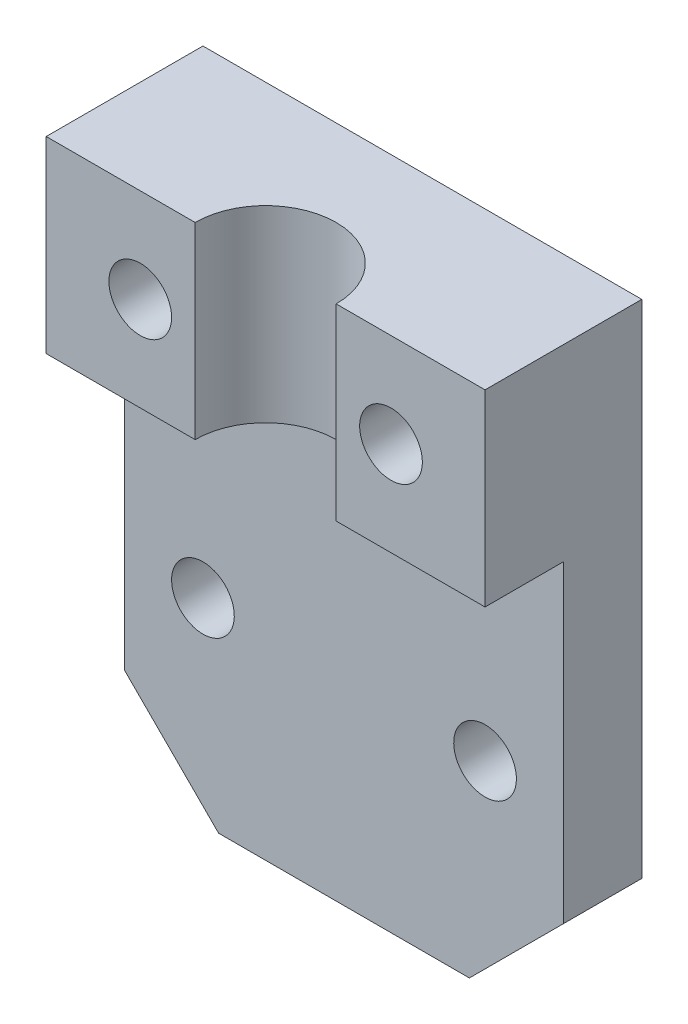
from build123d import *

# Parameters (mm, degrees)
SKETCH_1_R          = 2
EXTRUDE_1_DEPTH     = 10
CUT_EXTRUDE_2_REACH = 1024.045
SKETCH_2_W          = 6.505809731
SKETCH_2_H          = 33.357060804
SKETCH_3_R          = 4.5
CUT_EXTRUDE_3_DEPTH = 20


with BuildPart() as part:
    # 草图1 → 拉伸1 (new body)
    with BuildSketch(Plane.XY):
        Polygon((1243.510947309, 989.612625701), (1243.510947309, 1021.612625701), (1271.510947309, 1021.612625701), (1271.510947309, 989.612625701), (1265.510947309, 983.612625701), (1249.510947309, 983.612625701), align=None)
        with Locations((1265.510947309, 1015.612625701)):
            Circle(SKETCH_1_R, mode=Mode.SUBTRACT)
        with Locations((1249.510947309, 1015.612625701)):
            Circle(SKETCH_1_R, mode=Mode.SUBTRACT)
        with Locations((1248.510947309, 996.112625701)):
            Circle(SKETCH_1_R, mode=Mode.SUBTRACT)
        with Locations((1266.510947309, 996.112625701)):
            Circle(SKETCH_1_R, mode=Mode.SUBTRACT)
    extrude(amount=EXTRUDE_1_DEPTH)

    # 草图2 → 拉伸2 (cut, up to next)
    with BuildSketch(Plane.ZY.offset(-1243.510947309), mode=Mode.PRIVATE) as cut_extrude_2_sk1:
        with Locations((8.252904865, 992.934095299)):
            Rectangle(SKETCH_2_W, SKETCH_2_H)
    cut_extrude_2_tool1 = extrude(cut_extrude_2_sk1.sketch, amount=-CUT_EXTRUDE_2_REACH, mode=Mode.PRIVATE) & part.part
    add(cut_extrude_2_tool1.solids().sort_by_distance((1243.510947, 992.934095, 8.252905))[0], mode=Mode.SUBTRACT)

    # 草图3 → 拉伸3 (cut)
    with BuildSketch(Plane(origin=(0, 1021.612625701, 0), x_dir=(1, 0, 0), z_dir=(0, 1, 0))):
        with Locations((1257.510947309, -10)):
            Circle(SKETCH_3_R)
    extrude(amount=-CUT_EXTRUDE_3_DEPTH, mode=Mode.SUBTRACT)


solid = part.part
